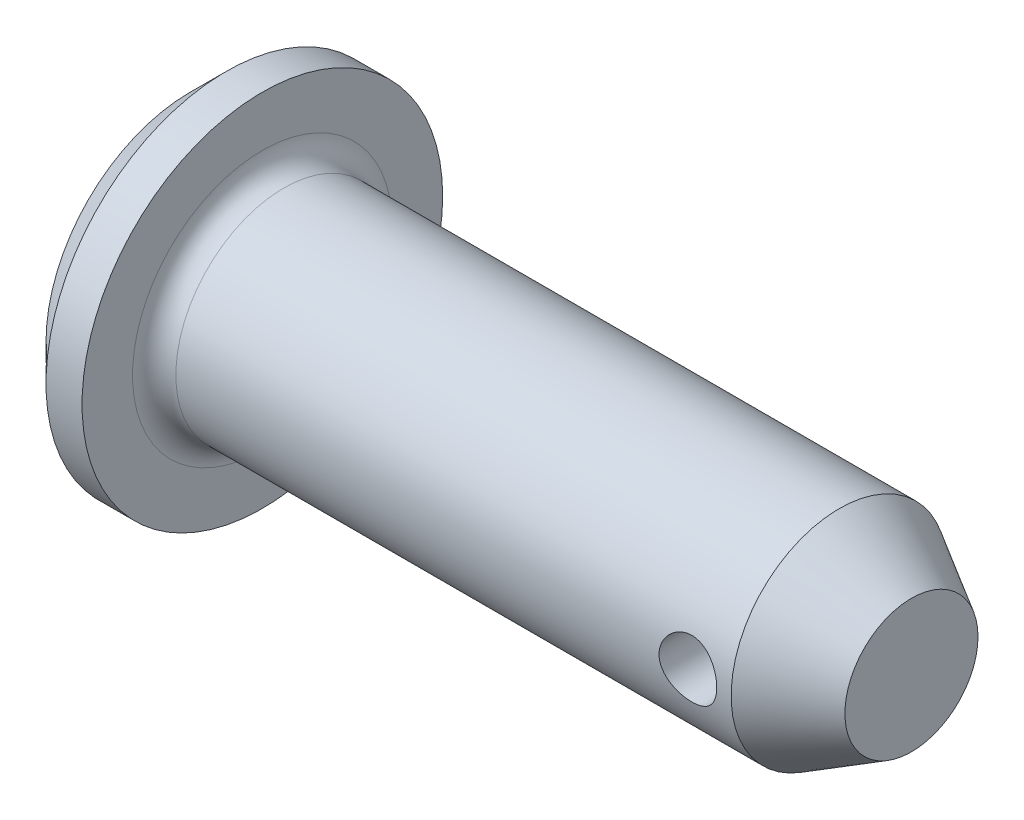
from build123d import *

# Parameters (mm, degrees)
CUT_EXTRUDE_1_DEPTH      = 22.213203436
CUT_EXTRUDE_1_DEPTH_BACK = 22.213203436
SKETCH_2_R               = 0.8
FILLET_1_R               = 0.6
CHAMFER_1_SIZE           = 2
CHAMFER_1_SIZE2          = 1.154700538


with BuildPart() as part:
    # 草图1 → Revolve 549 (revolve)
    with BuildSketch(Plane.XY, mode=Mode.PRIVATE) as revolve_549_sk:
        Polygon((0, 0), (20, 0), (20, 3), (2, 3), (2, 5), (1, 5), (0, 4), align=None)
    revolve(revolve_549_sk.sketch.rotate(Axis((0, 0, 0), (-1, 0, 0)), 90), axis=Axis((0, 0, 0), (-1, 0, 0)))

    # 草图2 → 切除-拉伸1 (cut, two sides: drawn at the far end of the back side and taken through both)
    with BuildSketch(Plane.XY.offset(-CUT_EXTRUDE_1_DEPTH_BACK)):
        with Locations((16.8, 0)):
            Circle(SKETCH_2_R)
    extrude(amount=CUT_EXTRUDE_1_DEPTH + CUT_EXTRUDE_1_DEPTH_BACK, mode=Mode.SUBTRACT)

    # 圆角1
    fillet_1_edges = [part.edges().sort_by_distance(p)[0] for p in [
        (2, 0, 3),
    ]]
    fillet(fillet_1_edges, radius=FILLET_1_R)

    # 倒角1
    chamfer_1_edges = [part.edges().sort_by_distance(p)[0] for p in [
        (20, 0, 3),
    ]]
    chamfer_1_side = [part.faces().sort_by_distance(p)[0] for p in [
        (11.3, 0, 3),
    ]]
    chamfer(chamfer_1_edges, length=CHAMFER_1_SIZE, length2=CHAMFER_1_SIZE2, reference=chamfer_1_side[0])


solid = part.part
